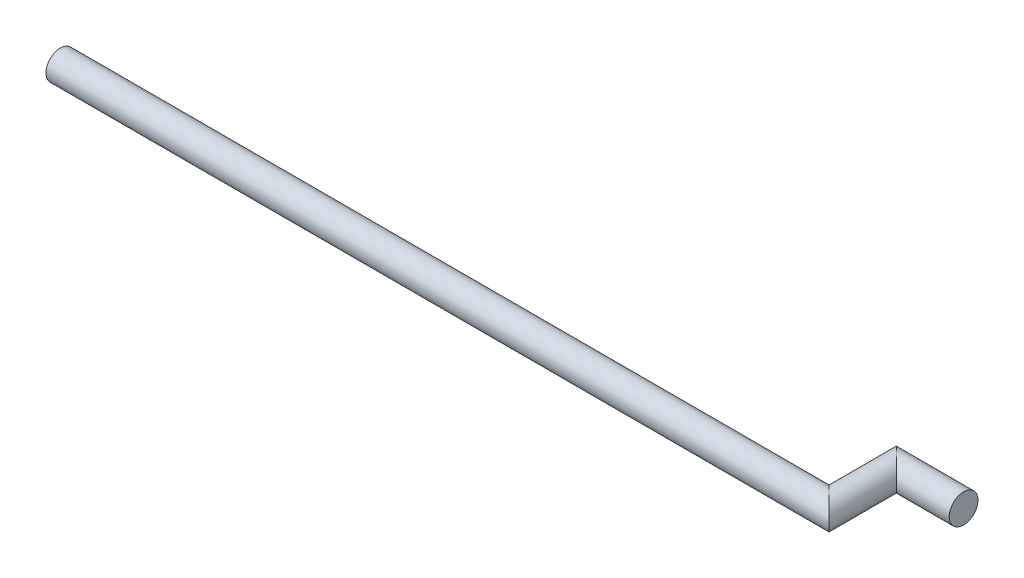
from build123d import *

# Parameters (mm, degrees)
SKETCH2_R = 0.75


with BuildPart() as part:
    # Sweep1: sweep along a path in Sketch1
    with BuildLine(Plane(origin=(0, 0, 0), x_dir=(1, 0, 0), z_dir=(0, 1, 0))) as sweep1_path:
        Line((0, 0), (40, 0))
        Line((40, 0), (40, 3.5))
        Line((40, 3.5), (43.5, 3.5))
    # Sketch2 → Sweep1 (sweep)
    with BuildSketch(Plane(origin=(0, 0, 0), x_dir=(0, 0, -1), z_dir=(1, 0, 0))):
        Circle(SKETCH2_R)
    sweep(path=sweep1_path.line, transition=Transition.RIGHT)


solid = part.part
